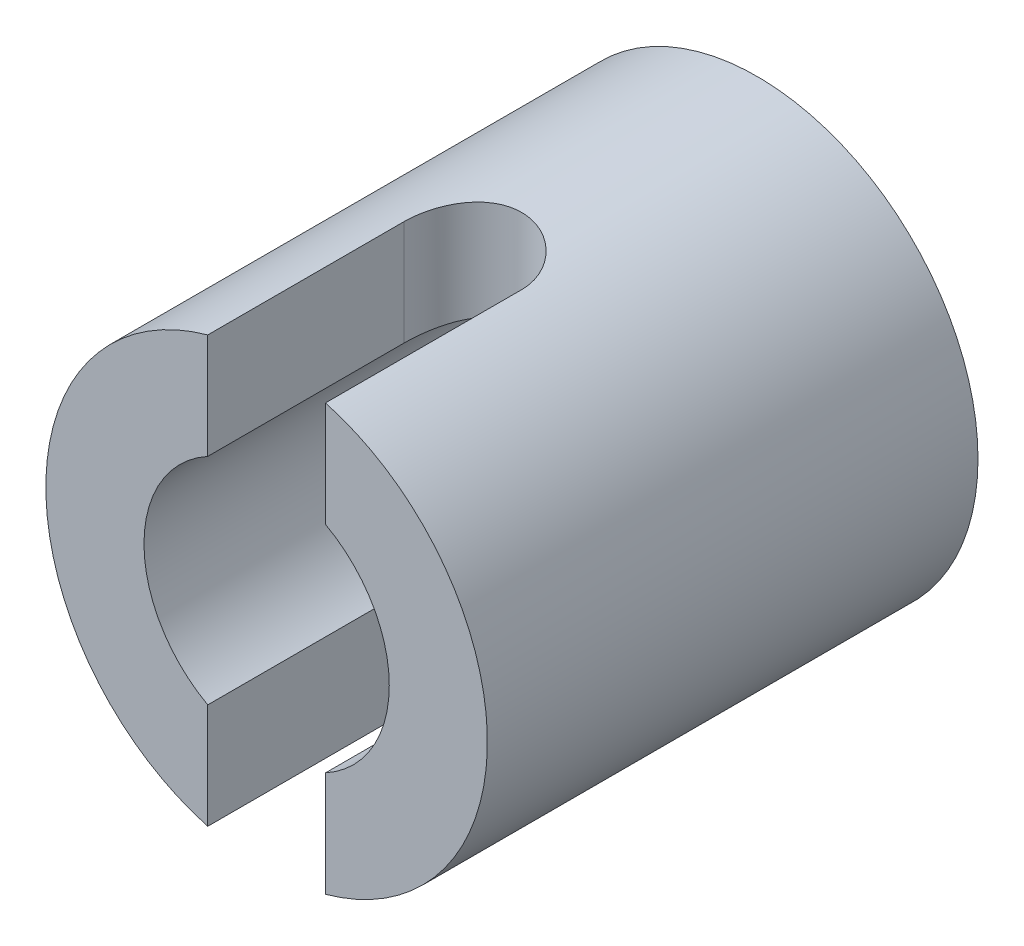
from build123d import *

# Parameters (mm, degrees)
SKETCH1_R               = 22.5
SKETCH1_R_2             = 12.5
BOSS_EXTRUDE1_DEPTH     = 50
CUT_EXTRUDE1_DEPTH      = 60.266347956
CUT_EXTRUDE1_DEPTH_BACK = 60.266347956


with BuildPart() as part:
    # Sketch1 → Boss-Extrude1 (new body)
    with BuildSketch(Plane.XY):
        Circle(SKETCH1_R)
        Circle(SKETCH1_R_2, mode=Mode.SUBTRACT)
    extrude(amount=BOSS_EXTRUDE1_DEPTH)

    # Sketch2 → Cut-Extrude1 (cut, two sides: drawn at the far end of the back side and taken through both)
    with BuildSketch(Plane(origin=(0, 0, 0), x_dir=(1, 0, 0), z_dir=(0, 1, 0)).offset(-CUT_EXTRUDE1_DEPTH_BACK)):
        with BuildLine():
            Line((6, -30), (6, -50))
            ThreePointArc((6, -50), (0, -56), (-6, -50))
            Line((-6, -50), (-6, -30))
            ThreePointArc((-6, -30), (0, -24), (6, -30))
        make_face()
    extrude(amount=CUT_EXTRUDE1_DEPTH + CUT_EXTRUDE1_DEPTH_BACK, mode=Mode.SUBTRACT)


solid = part.part
